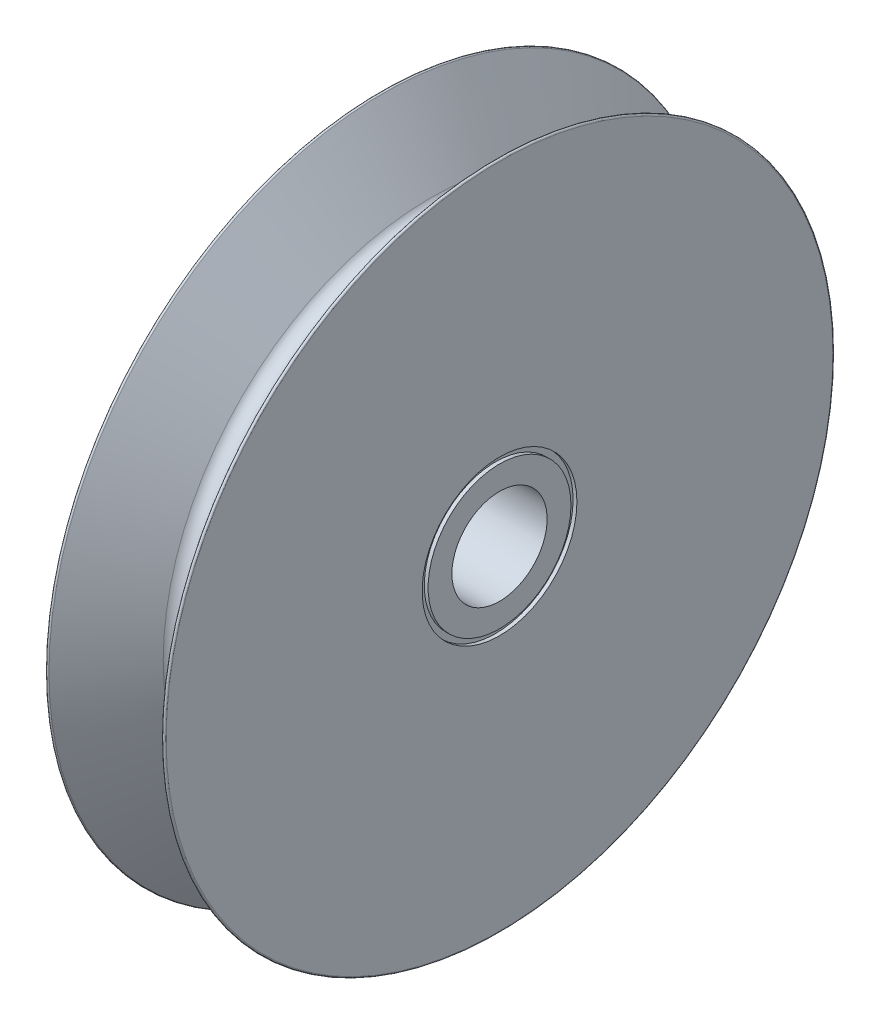
from build123d import *

# Parameters (mm, degrees)
SKETCH4_R          = 5.159375
SKETCH4_R_2        = 4.7625
CUT_EXTRUDE1_DEPTH = 0.254
CUT_EXTRUDE2_START = -0.254
SKETCH5_R          = 5.159375
SKETCH5_R_2        = 4.7625
CUT_EXTRUDE2_DEPTH = 0.254


with BuildPart() as part:
    # Sketch1 → Revolve1 (revolve)
    with BuildSketch(Plane.XY, mode=Mode.PRIVATE) as revolve1_sk:
        with BuildLine():
            Line((0, 3.175), (7.9375, 3.175))
            Line((7.9375, 3.175), (7.9375, 22.225))
            ThreePointArc((7.9375, 22.225), (7.867561539, 22.320374545), (7.755573923, 22.282342113))
            Line((7.755573923, 22.282342113), (4.619038236, 17.801096979))
            ThreePointArc((4.619038236, 17.801096979), (3.96875, 17.4625), (3.318461764, 17.801096979))
            Line((3.318461764, 17.801096979), (0.181926077, 22.282342113))
            ThreePointArc((0.181926077, 22.282342113), (0.069938461, 22.320374545), (0, 22.225))
            Line((0, 22.225), (0, 3.175))
        make_face()
    revolve(revolve1_sk.sketch.rotate(Axis((0, 0, 0), (1, 0, 0)), 90), axis=Axis((0, 0, 0), (1, 0, 0)))

    # Sketch4 → Cut-Extrude1 (cut)
    with BuildSketch(Plane(origin=(7.9375, 0, 0), x_dir=(0, 0, -1), z_dir=(1, 0, 0))):
        Circle(SKETCH4_R)
        Circle(SKETCH4_R_2, mode=Mode.SUBTRACT)
    extrude(amount=-CUT_EXTRUDE1_DEPTH, mode=Mode.SUBTRACT)

    # Sketch5 → Cut-Extrude2 (cut)
    with BuildSketch(Plane.ZY.offset(CUT_EXTRUDE2_START)):
        with Locations(Location((0, 0, 0), (0, 0, 180))):
            Circle(SKETCH5_R)
        with Locations(Location((0, 0, 0), (0, 0, 180))):
            Circle(SKETCH5_R_2, mode=Mode.SUBTRACT)
    extrude(amount=CUT_EXTRUDE2_DEPTH, mode=Mode.SUBTRACT)


solid = part.part
